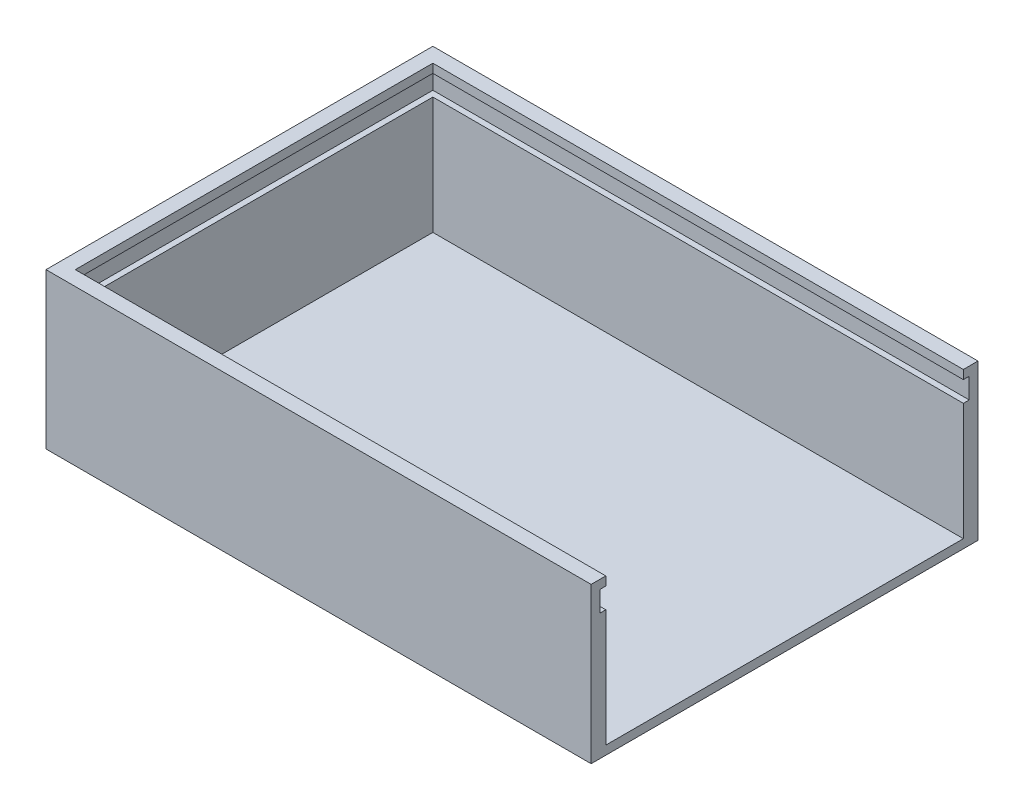
from build123d import *

# Parameters (mm, degrees)
ESQUISSE1_W             = 186
ESQUISSE1_H             = 132
BOSS_EXTRU_1_DEPTH      = 3
ESQUISSE4_W             = 5
ESQUISSE4_H             = 122
BOSS_EXTRU_4_DEPTH      = 50
ESQUISSE5_W             = 126
ESQUISSE5_H             = 7
ENL_V_MAT_EXTRU_1_DEPTH = 183


with BuildPart() as part:
    # Esquisse1 → Boss.-Extru.1 (new body)
    with BuildSketch(Plane(origin=(0, 0, 0), x_dir=(1, 0, 0), z_dir=(0, 1, 0))):
        Rectangle(ESQUISSE1_W, ESQUISSE1_H)
    extrude(amount=BOSS_EXTRU_1_DEPTH)

    # Esquisse4 → Boss.-Extru.4 (add)
    with BuildSketch(Plane(origin=(0, 3, 0), x_dir=(1, 0, 0), z_dir=(0, 1, 0))):
        Polygon((93, 61), (93, 66), (-93, 66), (-93, 61), (-88, 61), align=None)
        with Locations((-90.5, 0)):
            Rectangle(ESQUISSE4_W, ESQUISSE4_H)
        Polygon((93, -66), (93, -61), (-88, -61), (-93, -61), (-93, -66), align=None)
    extrude(amount=BOSS_EXTRU_4_DEPTH)

    # Esquisse5 → Enlèv. mat.-Extru.1 (cut)
    with BuildSketch(Plane(origin=(93, 0, 0), x_dir=(0, 0, -1), z_dir=(1, 0, 0))):
        with Locations((0, 46.5)):
            Rectangle(ESQUISSE5_W, ESQUISSE5_H)
    extrude(amount=-ENL_V_MAT_EXTRU_1_DEPTH, mode=Mode.SUBTRACT)


solid = part.part
